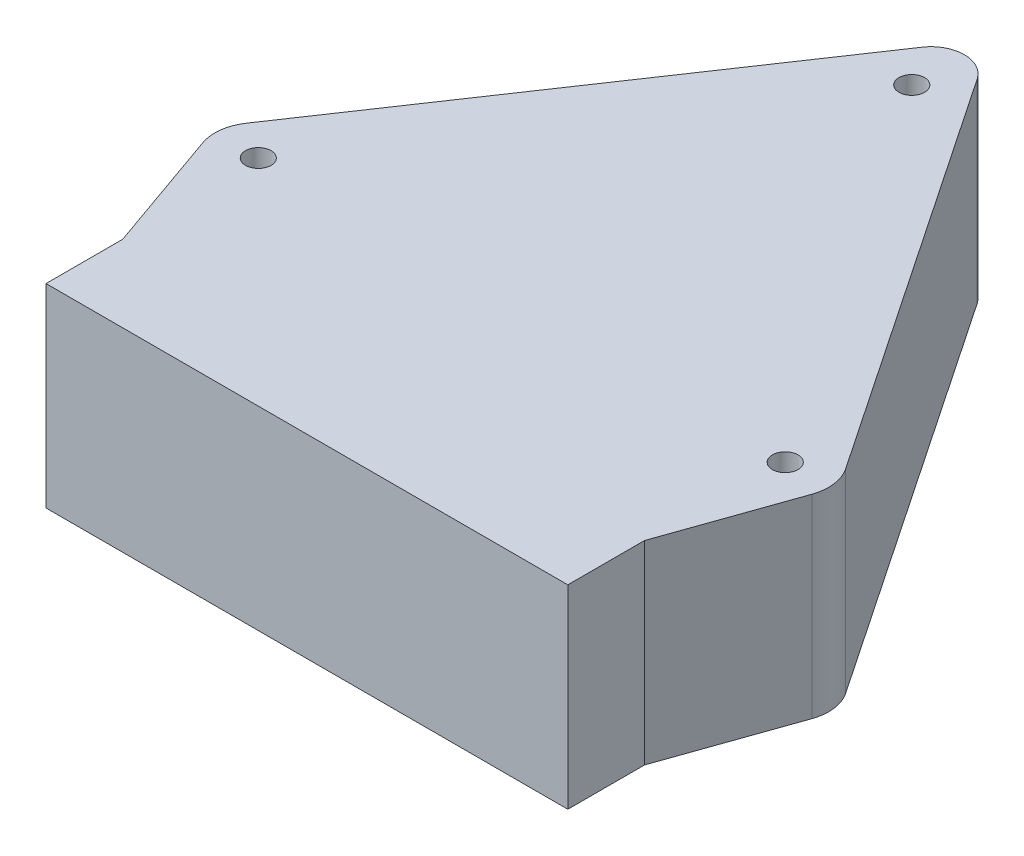
from build123d import *

# Parameters (mm, degrees)
BASE_MODEL_DEPTH         = 19
F_5_0_5_DIAMETER_HOLE1_D = 5


with BuildPart() as part:
    # Top → Base Model (new, symmetric)
    with BuildSketch(Plane(origin=(0, 0, 0), x_dir=(1, 0, 0), z_dir=(0, 1, 0))):
        with BuildLine():
            Line((-5.390272104, 50.397653109), (-58.548817366, -28.484658378))
            ThreePointArc((-58.548817366, -28.484658378), (-59.931398216, -32.157094268), (-59.517033361, -36.059224064))
            Line((-59.517033361, -36.059224064), (-51, -60.234834557))
            Line((-51, -60.234834557), (-51, -75.234834557))
            Line((-51, -75.234834557), (51, -75.234834557))
            Line((51, -75.234834557), (51, -60.234834557))
            Line((51, -60.234834557), (59.517033361, -36.059224064))
            ThreePointArc((59.517033361, -36.059224064), (59.931398216, -32.157094268), (58.548817366, -28.484658378))
            Line((58.548817366, -28.484658378), (5.390272104, 50.397653109))
            ThreePointArc((5.390272104, 50.397653109), (3.052771705, 52.503683101), (0, 53.265165443))
            ThreePointArc((0, 53.265165443), (-3.052771705, 52.503683101), (-5.390272104, 50.397653109))
        make_face()
    extrude(amount=BASE_MODEL_DEPTH, both=True)

    # Ø5.0 (5) Diameter Hole1 (through all)
    with Locations(Plane(origin=(0, 19, 0), x_dir=(1, 0, 0), z_dir=(0, 1, 0))):
        with Locations((-51.5, -33.234834557), (0, 43), (51.5, -33.234834557)):
            Hole(F_5_0_5_DIAMETER_HOLE1_D / 2)


solid = part.part
